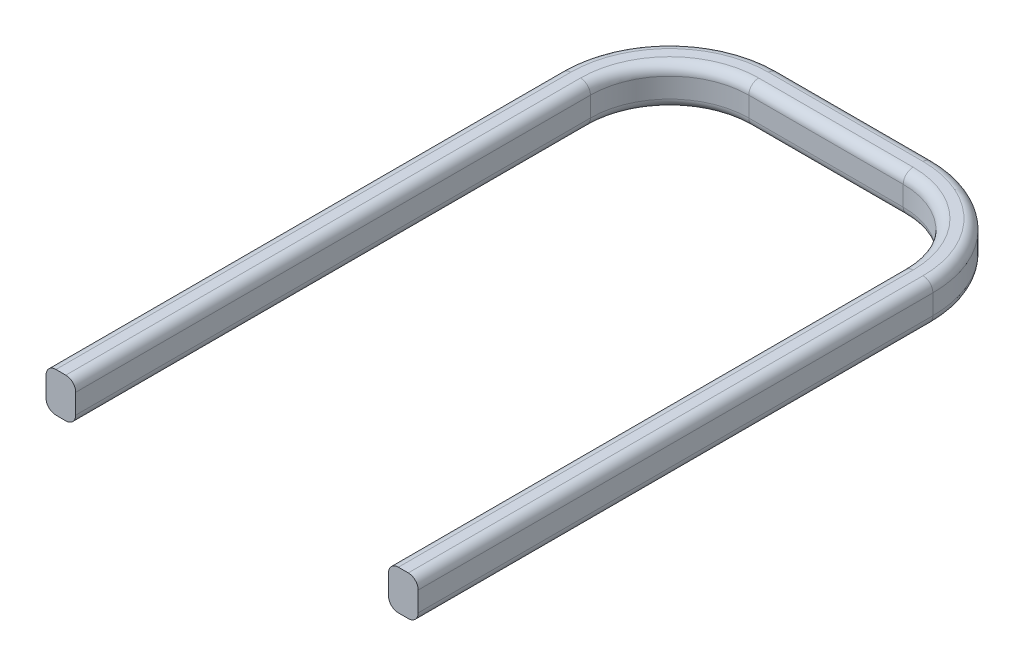
from build123d import *

# Parameters (mm, degrees)
BOSS_EXTRUDE1_DEPTH = 1
FILLET1_R           = 0.25


with BuildPart() as part:
    # Sketch1 → Boss-Extrude1 (new body)
    with BuildSketch(Plane(origin=(0, 0, 0), x_dir=(1, 0, 0), z_dir=(0, 1, 0))):
        with BuildLine():
            Line((-3.95, 0), (-3.95, 13))
            ThreePointArc((-3.95, 13), (-3.364213562, 14.414213562), (-1.95, 15))
            Line((-1.95, 15), (1.95, 15))
            ThreePointArc((1.95, 15), (3.364213562, 14.414213562), (3.95, 13))
            Line((3.95, 13), (3.95, 0))
            Line((3.95, 0), (4.7, 0))
            Line((4.7, 0), (4.7, 13))
            ThreePointArc((4.7, 13), (3.894543648, 14.944543648), (1.95, 15.75))
            Line((1.95, 15.75), (-1.95, 15.75))
            ThreePointArc((-1.95, 15.75), (-3.894543648, 14.944543648), (-4.7, 13))
            Line((-4.7, 13), (-4.7, 0))
            Line((-4.7, 0), (-3.95, 0))
        make_face()
    extrude(amount=BOSS_EXTRUDE1_DEPTH)

    # Fillet1
    fillet1_edges = [part.edges().sort_by_distance(p)[0] for p in [
        (-3.364213562, 1, -14.414213562),
        (-4.7, 0, -6.5),
        (-3.894543648, 0, -14.944543648),
        (0, 0, -15.75),
        (3.894543648, 0, -14.944543648),
        (4.7, 0, -6.5),
        (0, 1, -15),
        (3.95, 0, -6.5),
        (3.364213562, 0, -14.414213562),
        (0, 0, -15),
        (-3.364213562, 0, -14.414213562),
        (-3.95, 0, -6.5),
        (3.364213562, 1, -14.414213562),
        (3.95, 1, -6.5),
        (4.7, 1, -6.5),
        (3.894543648, 1, -14.944543648),
        (0, 1, -15.75),
        (-3.894543648, 1, -14.944543648),
        (-4.7, 1, -6.5),
        (-3.95, 1, -6.5),
    ]]
    fillet(fillet1_edges, radius=FILLET1_R)


solid = part.part
